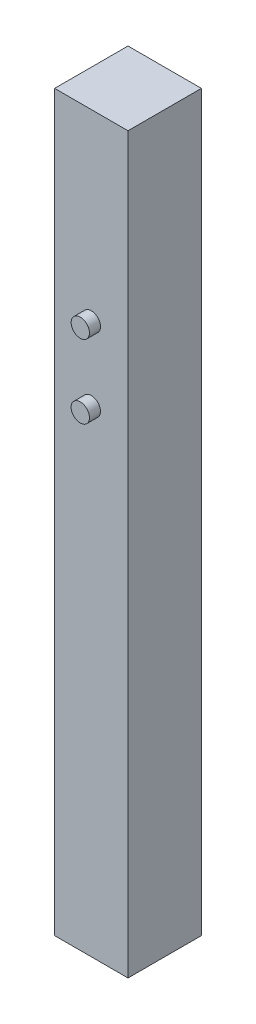
from build123d import *

# Parameters (mm, degrees)
SKETCH4_W           = 20
SKETCH4_H           = 20
BOSS_EXTRUDE2_DEPTH = 200
SKETCH5_R           = 2.5
BOSS_EXTRUDE3_DEPTH = 3


with BuildPart() as part:
    # Sketch4 → Boss-Extrude2 (new body)
    with BuildSketch(Plane(origin=(0, 0, 0), x_dir=(1, 0, 0), z_dir=(0, 1, 0))):
        with Locations((10, -10)):
            Rectangle(SKETCH4_W, SKETCH4_H)
    extrude(amount=BOSS_EXTRUDE2_DEPTH)

    # Sketch5 → Boss-Extrude3 (add)
    with BuildSketch(Plane.XY.offset(20)):
        with Locations(Location((10, 150, 0), (0, 0, 180))):
            Circle(SKETCH5_R)
        with Locations(Location((10, 130, 0), (0, 0, 180))):
            Circle(SKETCH5_R)
    extrude(amount=BOSS_EXTRUDE3_DEPTH)


solid = part.part
